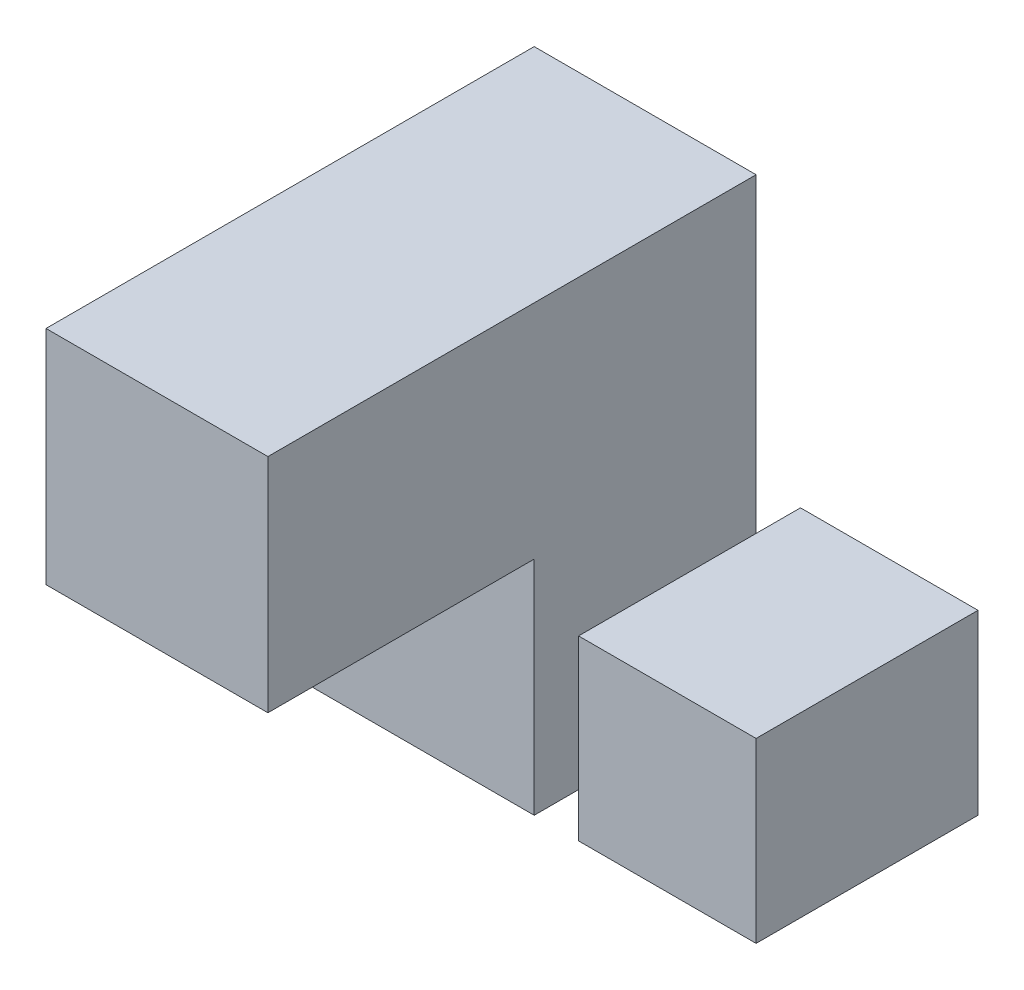
from build123d import *

# Parameters (mm, degrees)
SKETCH1_W           = 10
SKETCH1_H           = 20
BOSS_EXTRUDE1_DEPTH = 10
SKETCH2_W           = 10
SKETCH2_H           = 10
BOSS_EXTRUDE2_DEPTH = 22
SKETCH3_W           = 8
SKETCH3_H           = 8
BOSS_EXTRUDE3_DEPTH = 10


with BuildPart() as part:
    # Sketch1 → Boss-Extrude1 (new body)
    with BuildSketch(Plane.XY):
        with Locations((5, 10)):
            Rectangle(SKETCH1_W, SKETCH1_H)
    extrude(amount=BOSS_EXTRUDE1_DEPTH)

    # Sketch2 → Boss-Extrude2 (add)
    with BuildSketch(Plane.XY):
        with Locations((5, 15)):
            Rectangle(SKETCH2_W, SKETCH2_H)
    extrude(amount=BOSS_EXTRUDE2_DEPTH)


with BuildPart() as body_2:
    # Sketch3 → Boss-Extrude3 (new body)
    with BuildSketch(Plane.XY):
        with Locations((16, 4)):
            Rectangle(SKETCH3_W, SKETCH3_H)
    extrude(amount=BOSS_EXTRUDE3_DEPTH)


solid = Compound([part.part, body_2.part])
